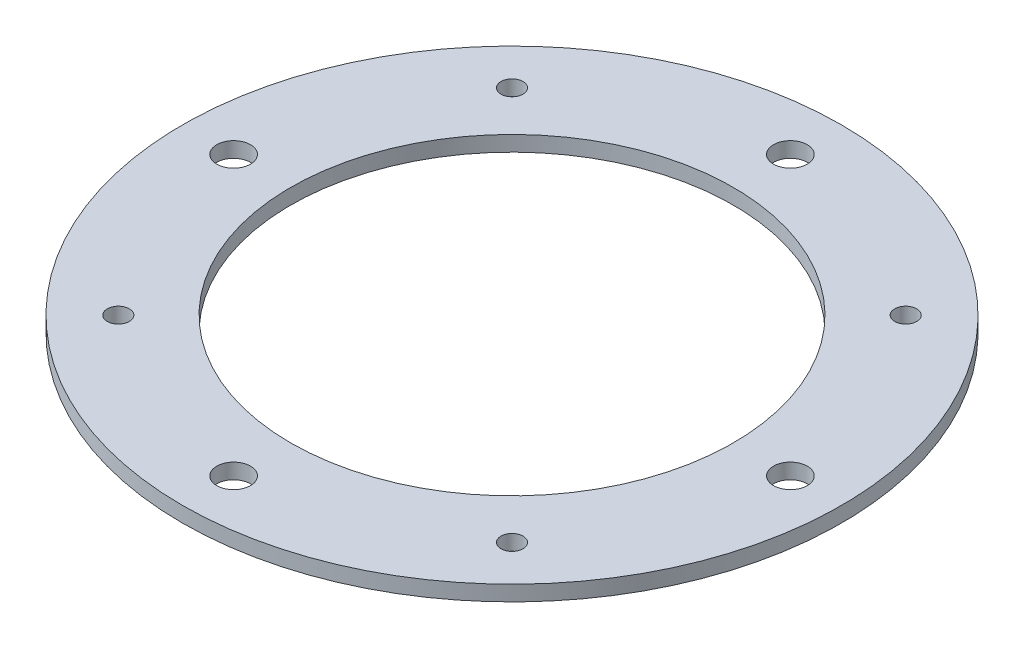
from build123d import *

# Parameters (mm, degrees)
SKETCH1_R            = 64.4
BOSS_EXTRUDE1_DEPTH  = 1.5
M6_CLEARANCE_HOLE1_D = 6.6
CIRPATTERN2_COUNT    = 4
M4_CLEARANCE_HOLE1_D = 4.3
CIRPATTERN1_COUNT    = 4
SKETCH10_R           = 43.25
CUT_EXTRUDE1_DEPTH   = 92.124749657


with BuildPart() as part:
    # Sketch1 → Boss-Extrude1 (new, symmetric)
    with BuildSketch(Plane(origin=(0, 0, 0), x_dir=(1, 0, 0), z_dir=(0, 1, 0))):
        with Locations(Location((0, 0, 0), (0, 0, 270))):
            Circle(SKETCH1_R)
    extrude(amount=BOSS_EXTRUDE1_DEPTH, both=True)

    # M6 Clearance Hole1 (through all)
    with Locations(Plane(origin=(0, 1.5, 0), x_dir=(1, 0, 0), z_dir=(0, 1, 0))):
        with Locations((54.4, 0)):
            m6_clearance_hole1 = Hole(M6_CLEARANCE_HOLE1_D / 2)

    # CirPattern2: M6 Clearance Hole1 ×4 about axis
    cirpattern2_axis = Axis((0, 0, 0), (0, 1, 0))
    for i in range(1, CIRPATTERN2_COUNT):
        add(m6_clearance_hole1.rotate(cirpattern2_axis, i * 360 / CIRPATTERN2_COUNT), mode=Mode.SUBTRACT)

    # M4 Clearance Hole1 (through all)
    with Locations(Plane(origin=(0, 1.5, 0), x_dir=(1, 0, 0), z_dir=(0, 1, 0))):
        with Locations((38.466608897, 38.466608897)):
            m4_clearance_hole1 = Hole(M4_CLEARANCE_HOLE1_D / 2)

    # CirPattern1: M4 Clearance Hole1 ×4 about axis
    cirpattern1_axis = Axis((0, 0, 0), (0, 1, 0))
    for i in range(1, CIRPATTERN1_COUNT):
        add(m4_clearance_hole1.rotate(cirpattern1_axis, i * 360 / CIRPATTERN1_COUNT), mode=Mode.SUBTRACT)

    # Sketch10 → Cut-Extrude1 (cut, through all)
    with BuildSketch(Plane(origin=(0, 1.5, 0), x_dir=(1, 0, 0), z_dir=(0, 1, 0))):
        with Locations(Location((0, 0, 0), (0, 0, 270))):
            Circle(SKETCH10_R)
    extrude(amount=-CUT_EXTRUDE1_DEPTH, mode=Mode.SUBTRACT)


solid = part.part
